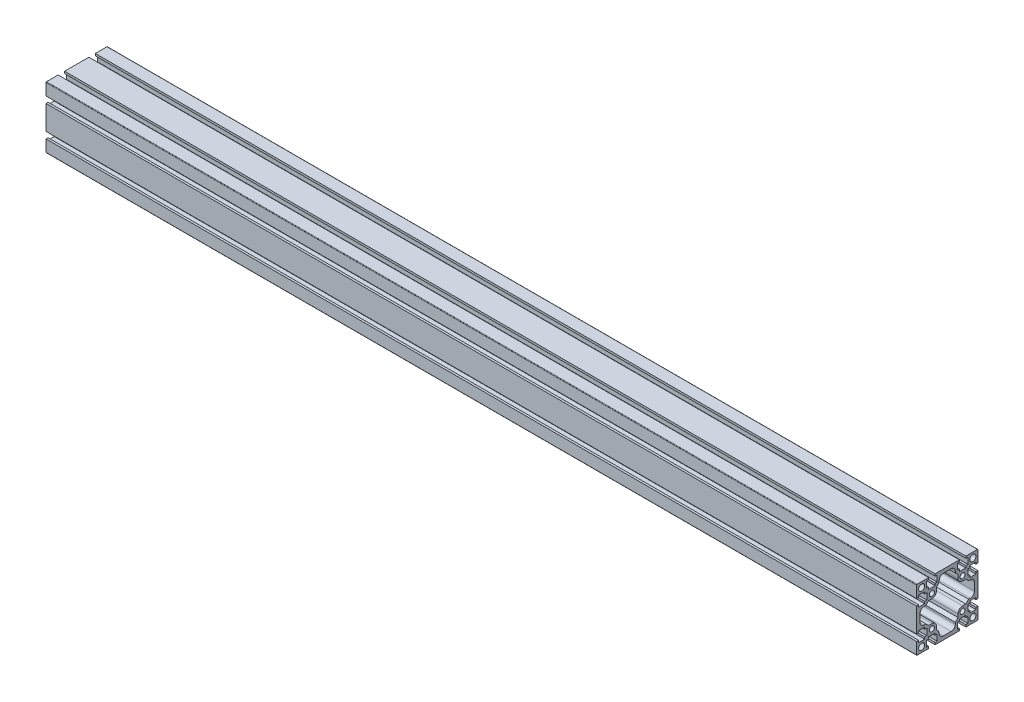
from build123d import *

# Parameters (mm, degrees)
SKETCH_14_R                 = 3
SKETCH_14_R_2               = 2.5
GB_T5237_2004_6060G_1_DEPTH = 850


with BuildPart() as part:
    # 草图14 → 铝型材（gb t5237-2004） 6060G(1) (new body)
    with BuildSketch(Plane.YZ.offset(-425)):
        with BuildLine():
            Line((28, -18.15), (30, -18.15))
            Line((30, -18.15), (30, -29.5))
            ThreePointArc((30, -29.5), (29.853553391, -29.853553391), (29.5, -30))
            Line((29.5, -30), (18.15, -30))
            Line((18.15, -30), (18.15, -28))
            Line((18.15, -28), (20.15, -28))
            Line((20.15, -28), (20.15, -22))
            Line((20.15, -22), (18.15, -22))
            Line((18.15, -22), (18.15, -20))
            Line((18.15, -20), (11.85, -20))
            Line((11.85, -20), (11.85, -22))
            Line((11.85, -22), (9.85, -22))
            Line((9.85, -22), (9.85, -28))
            Line((9.85, -28), (11.85, -28))
            Line((11.85, -28), (11.85, -30))
            Line((11.85, -30), (-11.85, -30))
            Line((-11.85, -30), (-11.85, -28))
            Line((-11.85, -28), (-9.85, -28))
            Line((-9.85, -28), (-9.85, -22))
            Line((-9.85, -22), (-11.85, -22))
            Line((-11.85, -22), (-11.85, -20))
            Line((-11.85, -20), (-18.15, -20))
            Line((-18.15, -20), (-18.15, -22))
            Line((-18.15, -22), (-20.15, -22))
            Line((-20.15, -22), (-20.15, -28))
            Line((-20.15, -28), (-18.15, -28))
            Line((-18.15, -28), (-18.15, -30))
            Line((-18.15, -30), (-29.5, -30))
            ThreePointArc((-29.5, -30), (-29.853553391, -29.853553391), (-30, -29.5))
            Line((-30, -29.5), (-30, -18.15))
            Line((-30, -18.15), (-28, -18.15))
            Line((-28, -18.15), (-28, -20.15))
            Line((-28, -20.15), (-22, -20.15))
            Line((-22, -20.15), (-22, -18.15))
            Line((-22, -18.15), (-20, -18.15))
            Line((-20, -18.15), (-20, -11.85))
            Line((-20, -11.85), (-22, -11.85))
            Line((-22, -11.85), (-22, -9.85))
            Line((-22, -9.85), (-28, -9.85))
            Line((-28, -9.85), (-28, -11.85))
            Line((-28, -11.85), (-30, -11.85))
            Line((-30, -11.85), (-30, 11.85))
            Line((-30, 11.85), (-28, 11.85))
            Line((-28, 11.85), (-28, 9.85))
            Line((-28, 9.85), (-22, 9.85))
            Line((-22, 9.85), (-22, 11.85))
            Line((-22, 11.85), (-20, 11.85))
            Line((-20, 11.85), (-20, 18.15))
            Line((-20, 18.15), (-22, 18.15))
            Line((-22, 18.15), (-22, 20.15))
            Line((-22, 20.15), (-28, 20.15))
            Line((-28, 20.15), (-28, 18.15))
            Line((-28, 18.15), (-30, 18.15))
            Line((-30, 18.15), (-30, 29.5))
            ThreePointArc((-30, 29.5), (-29.853553391, 29.853553391), (-29.5, 30))
            Line((-29.5, 30), (-18.15, 30))
            Line((-18.15, 30), (-18.15, 28))
            Line((-18.15, 28), (-20.15, 28))
            Line((-20.15, 28), (-20.15, 22))
            Line((-20.15, 22), (-18.15, 22))
            Line((-18.15, 22), (-18.15, 20))
            Line((-18.15, 20), (-11.85, 20))
            Line((-11.85, 20), (-11.85, 22))
            Line((-11.85, 22), (-9.85, 22))
            Line((-9.85, 22), (-9.85, 28))
            Line((-9.85, 28), (-11.85, 28))
            Line((-11.85, 28), (-11.85, 30))
            Line((-11.85, 30), (11.85, 30))
            Line((11.85, 30), (11.85, 28))
            Line((11.85, 28), (9.85, 28))
            Line((9.85, 28), (9.85, 22))
            Line((9.85, 22), (11.85, 22))
            Line((11.85, 22), (11.85, 20))
            Line((11.85, 20), (18.15, 20))
            Line((18.15, 20), (18.15, 22))
            Line((18.15, 22), (20.15, 22))
            Line((20.15, 22), (20.15, 28))
            Line((20.15, 28), (18.15, 28))
            Line((18.15, 28), (18.15, 30))
            Line((18.15, 30), (29.5, 30))
            ThreePointArc((29.5, 30), (29.853553391, 29.853553391), (30, 29.5))
            Line((30, 29.5), (30, 18.15))
            Line((30, 18.15), (28, 18.15))
            Line((28, 18.15), (28, 20.15))
            Line((28, 20.15), (22, 20.15))
            Line((22, 20.15), (22, 18.15))
            Line((22, 18.15), (20, 18.15))
            Line((20, 18.15), (20, 11.85))
            Line((20, 11.85), (22, 11.85))
            Line((22, 11.85), (22, 9.85))
            Line((22, 9.85), (28, 9.85))
            Line((28, 9.85), (28, 11.85))
            Line((28, 11.85), (30, 11.85))
            Line((30, 11.85), (30, -11.85))
            Line((30, -11.85), (28, -11.85))
            Line((28, -11.85), (28, -9.85))
            Line((28, -9.85), (22, -9.85))
            Line((22, -9.85), (22, -11.85))
            Line((22, -11.85), (20, -11.85))
            Line((20, -11.85), (20, -18.15))
            Line((20, -18.15), (22, -18.15))
            Line((22, -18.15), (22, -20.15))
            Line((22, -20.15), (28, -20.15))
            Line((28, -20.15), (28, -18.15))
        make_face()
        with Locations((25, 25)):
            Circle(SKETCH_14_R, mode=Mode.SUBTRACT)
        with Locations((-15, 15)):
            Circle(SKETCH_14_R_2, mode=Mode.SUBTRACT)
        with Locations((-25, -25)):
            Circle(SKETCH_14_R, mode=Mode.SUBTRACT)
        with Locations((25, -25)):
            Circle(SKETCH_14_R, mode=Mode.SUBTRACT)
        with Locations((15, -15)):
            Circle(SKETCH_14_R_2, mode=Mode.SUBTRACT)
        with Locations((-15, -15)):
            Circle(SKETCH_14_R_2, mode=Mode.SUBTRACT)
        with Locations((-25, 25)):
            Circle(SKETCH_14_R, mode=Mode.SUBTRACT)
        with Locations((15, 15)):
            Circle(SKETCH_14_R_2, mode=Mode.SUBTRACT)
        with BuildLine():
            Line((18.15, -10.5), (20.8, -7.85))
            Line((20.8, -7.85), (22.5, -7.85))
            ThreePointArc((22.5, -7.85), (25.328427125, -6.678427125), (26.5, -3.85))
            Line((26.5, -3.85), (26.5, 3.85))
            ThreePointArc((26.5, 3.85), (25.328427125, 6.678427125), (22.5, 7.85))
            Line((22.5, 7.85), (20.8, 7.85))
            Line((20.8, 7.85), (18.15, 10.5))
            Line((18.15, 10.5), (15, 10.5))
            ThreePointArc((15, 10.5), (11.818019485, 11.818019485), (10.5, 15))
            Line((10.5, 15), (10.5, 18.15))
            Line((10.5, 18.15), (7.85, 20.8))
            Line((7.85, 20.8), (7.85, 22.5))
            ThreePointArc((7.85, 22.5), (6.678427125, 25.328427125), (3.85, 26.5))
            Line((3.85, 26.5), (-3.85, 26.5))
            ThreePointArc((-3.85, 26.5), (-6.678427125, 25.328427125), (-7.85, 22.5))
            Line((-7.85, 22.5), (-7.85, 20.8))
            Line((-7.85, 20.8), (-10.5, 18.15))
            Line((-10.5, 18.15), (-10.5, 15))
            ThreePointArc((-10.5, 15), (-11.818019485, 11.818019485), (-15, 10.5))
            Line((-15, 10.5), (-18.15, 10.5))
            Line((-18.15, 10.5), (-20.8, 7.85))
            Line((-20.8, 7.85), (-22.5, 7.85))
            ThreePointArc((-22.5, 7.85), (-25.328427125, 6.678427125), (-26.5, 3.85))
            Line((-26.5, 3.85), (-26.5, -3.85))
            ThreePointArc((-26.5, -3.85), (-25.328427125, -6.678427125), (-22.5, -7.85))
            Line((-22.5, -7.85), (-20.8, -7.85))
            Line((-20.8, -7.85), (-18.15, -10.5))
            Line((-18.15, -10.5), (-15, -10.5))
            ThreePointArc((-15, -10.5), (-11.818019485, -11.818019485), (-10.5, -15))
            Line((-10.5, -15), (-10.5, -18.15))
            Line((-10.5, -18.15), (-7.85, -20.8))
            Line((-7.85, -20.8), (-7.85, -22.5))
            ThreePointArc((-7.85, -22.5), (-6.678427125, -25.328427125), (-3.85, -26.5))
            Line((-3.85, -26.5), (3.85, -26.5))
            ThreePointArc((3.85, -26.5), (6.678427125, -25.328427125), (7.85, -22.5))
            Line((7.85, -22.5), (7.85, -20.8))
            Line((7.85, -20.8), (10.5, -18.15))
            Line((10.5, -18.15), (10.5, -15))
            ThreePointArc((10.5, -15), (11.818019485, -11.818019485), (15, -10.5))
            Line((15, -10.5), (18.15, -10.5))
        make_face(mode=Mode.SUBTRACT)
    extrude(amount=GB_T5237_2004_6060G_1_DEPTH)


solid = part.part
